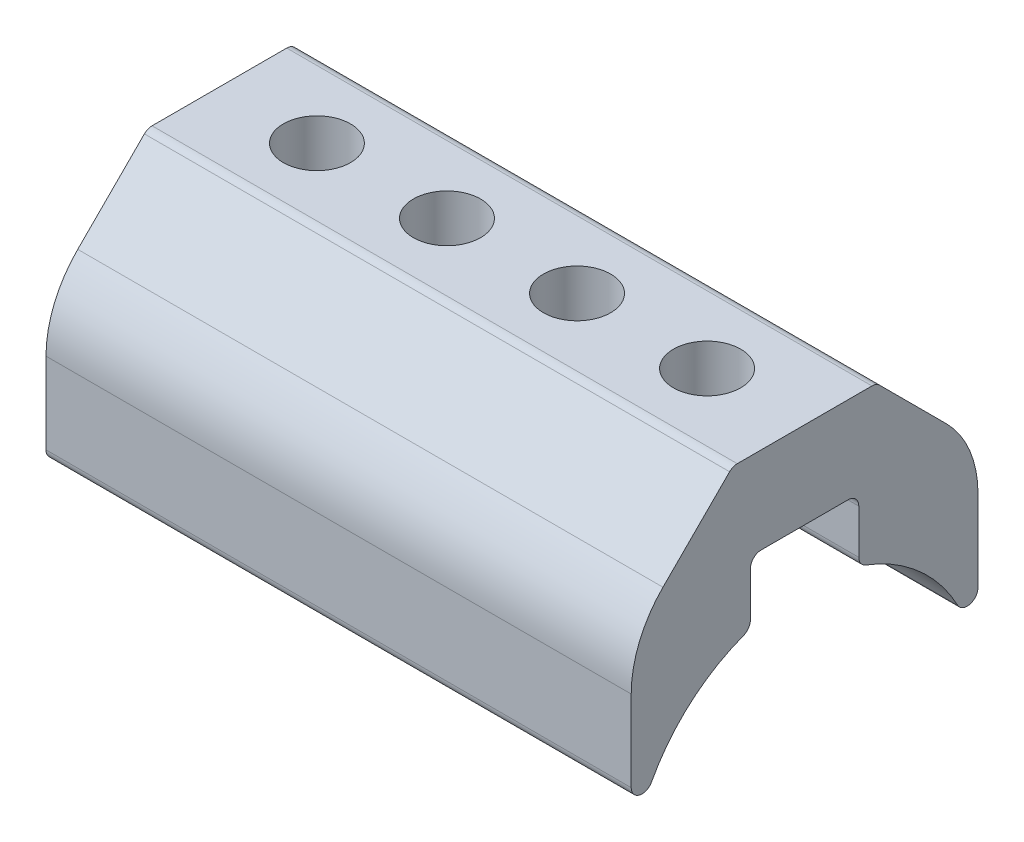
from build123d import *

# Parameters (mm, degrees)
BOSS_EXTRUDE1_DEPTH     = 54
CUT_EXTRUDE1_DEPTH      = 61.464865831
CUT_EXTRUDE1_DEPTH_BACK = 61.464865831
SKETCH2_R               = 2
SKETCH2_4_R             = 3.1
SKETCH2_4_R_2           = 2
CUT_EXTRUDE2_DEPTH      = 5
CUT_EXTRUDE7_DEPTH      = 64.348243944
CUT_EXTRUDE7_DEPTH_BACK = 64.348243944
FILLET1_R               = 1
FILLET2_R               = 10


with BuildPart() as part:
    # Sketch1 → Boss-Extrude1 (new body)
    with BuildSketch(Plane(origin=(0, 0, 0), x_dir=(0, 0, -1), z_dir=(1, 0, 0))):
        with BuildLine():
            Line((16, 8), (16, 19.627416998))
            Line((16, 19.627416998), (6.627416998, 29))
            Line((6.627416998, 29), (-6.627416998, 29))
            Line((-6.627416998, 29), (-16, 19.627416998))
            Line((-16, 19.627416998), (-16, 8))
            ThreePointArc((-16, 8), (-15.242535625, 7.0298575), (-14.117647059, 7.529411765))
            ThreePointArc((-14.117647059, 7.529411765), (0, 16), (14.117647059, 7.529411765))
            ThreePointArc((14.117647059, 7.529411765), (15.242535625, 7.0298575), (16, 8))
        make_face()
    extrude(amount=BOSS_EXTRUDE1_DEPTH)

    # Sketch2 → Cut-Extrude1 (cut, two sides: drawn at the far end of the back side and taken through both)
    with BuildSketch(Plane(origin=(0, 29, 0), x_dir=(1, 0, 0), z_dir=(0, 1, 0)).offset(-CUT_EXTRUDE1_DEPTH_BACK)):
        with Locations((9, 0)):
            Circle(SKETCH2_R)
        with Locations((21, 0)):
            Circle(SKETCH2_R)
        with Locations((33, 0)):
            Circle(SKETCH2_R)
        with Locations((45, 0)):
            Circle(SKETCH2_R)
    extrude(amount=CUT_EXTRUDE1_DEPTH + CUT_EXTRUDE1_DEPTH_BACK, mode=Mode.SUBTRACT)

    # Sketch2<4> → Cut-Extrude2 (cut)
    # profile 1 of 4: a face of its own
    with BuildSketch(Plane(origin=(0, 29, 0), x_dir=(1, 0, 0), z_dir=(0, 1, 0))):
        with Locations((9, 0)):
            Circle(SKETCH2_4_R)
        with Locations((9, 0)):
            Circle(SKETCH2_4_R_2, mode=Mode.SUBTRACT)
    # profile 2 of 4: a face of its own
    with BuildSketch(Plane(origin=(0, 29, 0), x_dir=(1, 0, 0), z_dir=(0, 1, 0))):
        with Locations((21, 0)):
            Circle(SKETCH2_4_R)
        with Locations((21, 0)):
            Circle(SKETCH2_4_R_2, mode=Mode.SUBTRACT)
    # profile 3 of 4: a face of its own
    with BuildSketch(Plane(origin=(0, 29, 0), x_dir=(1, 0, 0), z_dir=(0, 1, 0))):
        with Locations((33, 0)):
            Circle(SKETCH2_4_R)
        with Locations((33, 0)):
            Circle(SKETCH2_4_R_2, mode=Mode.SUBTRACT)
    # profile 4 of 4: a face of its own
    with BuildSketch(Plane(origin=(0, 29, 0), x_dir=(1, 0, 0), z_dir=(0, 1, 0))):
        with Locations((45, 0)):
            Circle(SKETCH2_4_R)
        with Locations((45, 0)):
            Circle(SKETCH2_4_R_2, mode=Mode.SUBTRACT)
    extrude(amount=-CUT_EXTRUDE2_DEPTH, mode=Mode.SUBTRACT)

    # Sketch4 → Cut-Extrude7 (cut, two sides: drawn at the far end of the back side and taken through both)
    with BuildSketch(Plane.ZY.offset(-CUT_EXTRUDE7_DEPTH_BACK)):
        with BuildLine():
            Line((-5, 21), (-5, 15.198684154))
            ThreePointArc((-5, 15.198684154), (0, 16), (5, 15.198684154))
            Line((5, 15.198684154), (5, 21))
            Line((5, 21), (-5, 21))
        make_face()
    extrude(amount=CUT_EXTRUDE7_DEPTH + CUT_EXTRUDE7_DEPTH_BACK, mode=Mode.SUBTRACT)

    # Fillet1
    fillet1_edges = [part.edges().sort_by_distance(p)[0] for p in [
        (27, 15.198684154, -5),
        (27, 21, -5),
        (27, 15.198684154, 5),
        (27, 21, 5),
        (27, 29, -6.627416998),
        (27, 29, 6.627416998),
    ]]
    fillet(fillet1_edges, radius=FILLET1_R)

    # Fillet2
    fillet2_edges = [part.edges().sort_by_distance(p)[0] for p in [
        (27, 19.627416998, -16),
        (27, 19.627416998, 16),
    ]]
    fillet(fillet2_edges, radius=FILLET2_R)


solid = part.part
